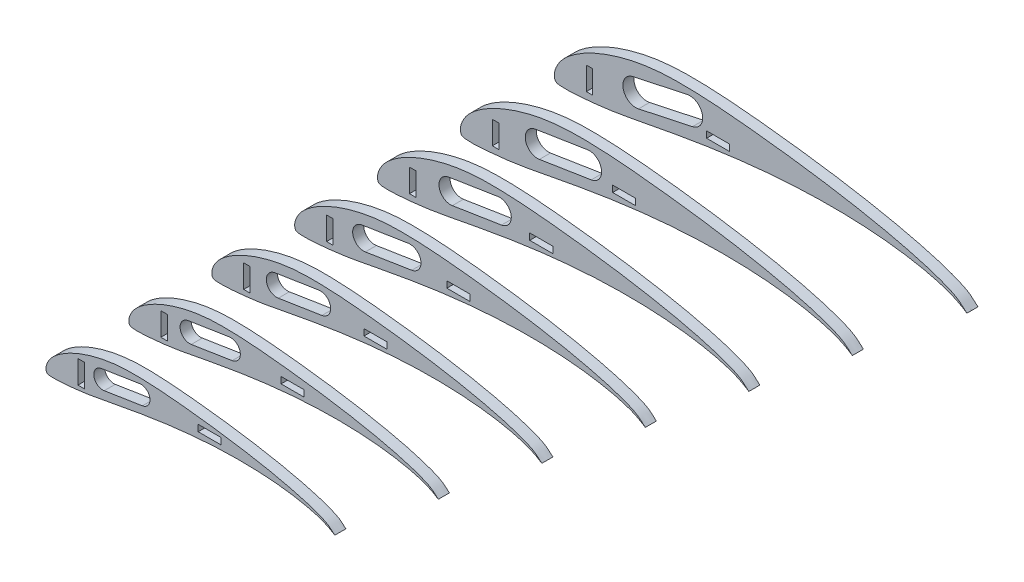
from build123d import *

# Parameters (mm, degrees)
BOSS_EXTRUDE1_DEPTH  = 6
CUT_EXTRUDE1_DEPTH   = 10
BOSS_EXTRUDE8_DEPTH  = 6
BOSS_EXTRUDE9_DEPTH  = 6
BOSS_EXTRUDE10_DEPTH = 6
BOSS_EXTRUDE11_DEPTH = 6
BOSS_EXTRUDE12_DEPTH = 6
BOSS_EXTRUDE13_DEPTH = 6
SKETCH11_W           = 3.5
SKETCH11_H           = 12.5
SKETCH11_W_2         = 12.5
SKETCH11_H_2         = 3.5
CUT_EXTRUDE2_DEPTH   = 362.412187266


with BuildPart() as part:
    # Sketch2 → Boss-Extrude1 (new body)
    with BuildSketch(Plane(origin=(0, 0, 0), x_dir=(0, 1, 0), z_dir=(0, 0, 1))):
        with BuildLine():
            add(Edge.make_bspline(
                [(0, -224), (0.005702412, -224.001341001), (0.554348448, -223.264970695), (1.165388694, -222.642205802), (2.44166658, -221.259416175), (3.799382204, -219.628047718), (5.168110619, -217.396475791), (6.494563188, -214.621499139), (7.878877108, -211.271449243), (9.301777091, -207.351432564), (10.753211404, -202.87973715), (12.220578138, -197.879577131), (13.696990178, -192.37895201), (15.168891242, -186.408233862), (16.625626309, -180.001654372), (18.058096621, -173.197398334), (19.458938187, -166.037015691), (20.810912823, -158.562355663), (22.112088945, -150.820487592), (23.34571141, -142.856028479), (24.514189105, -134.720484688), (25.60826243, -126.465995343), (26.624430408, -118.152347749), (27.56988806, -109.846003212), (28.420779048, -101.615725894), (29.161177978, -93.528566604), (29.749411157, -85.64140381), (30.154040087, -77.999291883), (30.328777712, -70.644746389), (30.310178033, -63.615443619), (29.966002817, -56.924495942), (29.268547246, -50.569311468), (28.282334726, -44.524019662), (27.004705112, -38.787161488), (25.50650617, -33.364630731), (23.814273297, -28.279370788), (21.967579419, -23.553008802), (19.976318444, -19.214914939), (17.880918697, -15.279001261), (15.705208923, -11.76668043), (13.478671875, -8.699978573), (11.2485017, -6.08016101), (8.990354416, -3.945219698), (6.723785626, -2.305312453), (4.518716045, -1.093954275), (2.42510695, -0.317601878), (0.492706389, 0.052330076), (-1.141646455, -0.019076802), (-2.640611366, -0.439847315), (-3.384708529, -2.003918685), (-3.489103018, -4.106833179), (-3.590282567, -6.983612367), (-3.434277467, -10.601365227), (-3.147587635, -14.919204004), (-2.688372693, -19.88907566), (-2.067035131, -25.460124636), (-1.270242167, -31.605185034), (-0.15660544, -38.321253852), (1.239876963, -45.641031053), (2.759695447, -53.601110597), (4.364405875, -62.162584264), (5.98740184, -71.271676995), (7.567774206, -80.861491288), (9.052750205, -90.857628696), (10.387855574, -101.173942968), (11.534215269, -111.717662379), (12.440365405, -122.389187836), (13.082714119, -133.081427951), (13.435848787, -143.682676261), (13.480452226, -154.077927826), (13.21349384, -164.151207334), (12.641223178, -173.787169766), (11.771024072, -182.869944039), (10.636299016, -191.291394287), (9.269973456, -198.941875925), (7.717807326, -205.731690442), (6.056920419, -211.535704676), (4.284278527, -216.285691763), (2.662084252, -219.674685277), (1.162148937, -222.173299724), (0.581698714, -223.13315995), (-0.005818341, -223.998631736), (0, -224)],
                knots=[0, 0, 0, 0, 0.000979678, 0.003648862, 0.007483499, 0.012095277, 0.017525591, 0.02405178, 0.031783051, 0.040677828, 0.050710301, 0.061833229, 0.07398925, 0.087118173, 0.101145049, 0.115990637, 0.131570422, 0.147788379, 0.164550917, 0.181757895, 0.199311955, 0.217095072, 0.234990228, 0.252856883, 0.270540594, 0.287886779, 0.304773438, 0.321101419, 0.336806063, 0.351800033, 0.366031063, 0.379615675, 0.392652963, 0.405170359, 0.417171919, 0.428603517, 0.439418959, 0.449596586, 0.459102079, 0.467907878, 0.475988301, 0.483308969, 0.489874508, 0.49580325, 0.501149412, 0.505903073, 0.510046769, 0.513579311, 0.516446927, 0.519350053, 0.523823355, 0.529973794, 0.537715654, 0.546967844, 0.557637367, 0.569620481, 0.582804124, 0.597246961, 0.613135037, 0.6304436, 0.649056124, 0.668822257, 0.689594964, 0.711189651, 0.733426689, 0.756094118, 0.778988554, 0.801889683, 0.824566598, 0.846792285, 0.868338291, 0.888978163, 0.908492011, 0.926658768, 0.943286193, 0.95816921, 0.971135822, 0.981955623, 0.990251791, 0.995852565, 0.999000406, 1, 1, 1, 1], degree=3))
        make_face()
    extrude(amount=BOSS_EXTRUDE1_DEPTH)

    # Sketch3 → Cut-Extrude1 (cut)
    with BuildSketch(Plane(origin=(0, 0, 0), x_dir=(1, 0, 0), z_dir=(0, 0, -1))):
        with BuildLine():
            Line((45.664943608, -6.8980064), (74.995985185, -13.1980064))
            ThreePointArc((74.995985185, -13.1980064), (80.369894886, -21.511916101), (72.055985185, -26.885825803))
            Line((72.055985185, -26.885825803), (42.724943608, -20.585825803))
            ThreePointArc((42.724943608, -20.585825803), (37.351033906, -12.271916101), (45.664943608, -6.8980064))
        make_face()
    extrude(amount=-CUT_EXTRUDE1_DEPTH, mode=Mode.SUBTRACT)


with BuildPart() as body_2:
    # Sketch5 → Boss-Extrude8 (new body)
    with BuildSketch(Plane(origin=(0, 0, -45), x_dir=(-1, 0, 0), z_dir=(0, 0, -1))):
        with BuildLine():
            add(Edge.make_bspline(
                [(-212.8, 0), (-212.79870015, -0.005527424), (-211.976501953, 0.552613778), (-211.064634738, 1.10404149), (-208.690951013, 2.528980039), (-205.471407175, 4.0700646), (-200.958919443, 5.754074398), (-195.44510592, 7.33191696), (-188.994782128, 8.806474783), (-181.726824573, 10.104484065), (-173.726446837, 11.182472868), (-165.097811278, 12.009162019), (-155.943646967, 12.552819148), (-146.374031435, 12.806429614), (-136.498542448, 12.764056347), (-126.427356553, 12.428578413), (-116.269728444, 11.818347135), (-106.13177926, 10.957504505), (-96.115245819, 9.868462796), (-86.314747261, 8.600112694), (-76.818416723, 7.189385496), (-67.708093146, 5.688031748), (-59.054455051, 4.146185582), (-50.921055067, 2.621710675), (-43.3589795, 1.177883115), (-36.405191159, -0.148775168), (-30.024925782, -1.206730058), (-24.187118405, -1.963683374), (-18.894621877, -2.553954058), (-14.173243804, -2.990208253), (-10.071296965, -3.262563593), (-6.634431749, -3.410768438), (-3.90149152, -3.314647867), (-1.90372275, -3.215473103), (-0.417854949, -2.508580798), (-0.018122962, -1.084564133), (0.049713573, 0.46807107), (-0.301721784, 2.303851603), (-1.039256561, 4.292780243), (-2.190046831, 6.387596345), (-3.747958713, 8.540836695), (-5.77615296, 10.686076615), (-8.264979645, 12.804738281), (-11.178346408, 14.919948477), (-14.515051198, 16.986872762), (-18.254169192, 18.977502521), (-22.375358362, 20.869200448), (-26.865402249, 22.623559632), (-31.696399194, 24.231180862), (-36.847803413, 25.654469857), (-42.297818679, 26.86821799), (-48.040845894, 27.805119884), (-54.078271145, 28.467702677), (-60.434671438, 28.794669132), (-67.11250907, 28.812338826), (-74.099327289, 28.646338083), (-81.359333619, 28.261940599), (-88.852138273, 27.703119079), (-96.534939599, 26.999740095), (-104.353703051, 26.191393657), (-112.244730361, 25.293208887), (-120.142695576, 24.327849308), (-127.984460453, 23.28847965), (-135.713227055, 22.178425839), (-143.279463212, 21.006484498), (-150.63423788, 19.770367182), (-157.735164906, 18.485991277), (-164.537528417, 17.15519179), (-171.001571654, 15.794344994), (-177.087822169, 14.41044668), (-182.76000441, 13.012140669), (-187.985598274, 11.609549231), (-192.735750292, 10.215550833), (-196.983860936, 8.836688236), (-200.707876781, 7.484933253), (-203.890424182, 6.169835028), (-206.526652002, 4.909705088), (-208.646645332, 3.609413094), (-210.196445366, 2.319583251), (-211.510095512, 1.107119259), (-212.10172216, 0.526631026), (-212.801273951, 0.005417291), (-212.8, 0)],
                knots=[0, 0, 0, 0, 0.000999594, 0.004147435, 0.009748209, 0.018044377, 0.028864178, 0.04183079, 0.056713807, 0.073341232, 0.091507989, 0.111021837, 0.131661709, 0.153207715, 0.175433402, 0.198110317, 0.221011446, 0.243905882, 0.266573311, 0.288810349, 0.310405036, 0.331177743, 0.350943876, 0.3695564, 0.386864963, 0.402753039, 0.417195876, 0.430379519, 0.442362633, 0.453032156, 0.462284346, 0.470026206, 0.476176645, 0.480649947, 0.483553073, 0.486420689, 0.489953231, 0.494096927, 0.498850588, 0.50419675, 0.510125492, 0.516691031, 0.524011699, 0.532092122, 0.540897921, 0.550403414, 0.560581041, 0.571396483, 0.582828081, 0.594829641, 0.607347037, 0.620384325, 0.633968937, 0.648199967, 0.663193937, 0.678898581, 0.695226562, 0.712113221, 0.729459406, 0.747143117, 0.765009772, 0.782904928, 0.800688045, 0.818242105, 0.835449083, 0.852211621, 0.868429578, 0.884009363, 0.898854951, 0.912881827, 0.92601075, 0.938166771, 0.949289699, 0.959322172, 0.968216949, 0.97594822, 0.982474409, 0.987904723, 0.992516501, 0.996351138, 0.999020322, 1, 1, 1, 1], degree=3))
        make_face()
        with BuildLine():
            Line((-40.804637579, 20.393372232), (-68.955851175, 24.838501372))
            ThreePointArc((-68.955851175, 24.838501372), (-76.56166448, 19.307081666), (-71.030244774, 11.701268361))
            Line((-71.030244774, 11.701268361), (-42.879031178, 7.25613922))
            ThreePointArc((-42.879031178, 7.25613922), (-35.273217873, 12.787558927), (-40.804637579, 20.393372232))
        make_face(mode=Mode.SUBTRACT)
    extrude(amount=BOSS_EXTRUDE8_DEPTH)


with BuildPart() as body_3:
    # Sketch6 → Boss-Extrude9 (new body)
    with BuildSketch(Plane(origin=(0, 0, -90), x_dir=(-1, 0, 0), z_dir=(0, 0, -1))):
        with BuildLine():
            add(Edge.make_bspline(
                [(-201.6, 0), (-201.598768563, -0.005236507), (-200.819843955, 0.523528843), (-199.955969751, 1.045934044), (-197.707216749, 2.395875827), (-194.657122586, 3.855850674), (-190.382134209, 5.451228377), (-185.158521398, 6.946026594), (-179.047688332, 8.34297611), (-172.162254859, 9.572669115), (-164.582949635, 10.593921664), (-156.408452789, 11.37710086), (-147.7360866, 11.892144456), (-138.670135043, 12.132407003), (-129.314408635, 12.092263908), (-119.773285155, 11.774442707), (-110.150269052, 11.196328865), (-100.545896141, 10.380793742), (-91.056548671, 9.349070017), (-81.771865826, 8.147475184), (-72.775342159, 6.810996786), (-64.144509296, 5.388661656), (-55.946325838, 3.927965288), (-48.240999537, 2.483725902), (-41.076927948, 1.115889267), (-34.489128466, -0.140944896), (-28.44466653, -1.14321795), (-22.914112173, -1.860331618), (-17.900168094, -2.419535423), (-13.427283603, -2.832828872), (-9.541228704, -3.09084972), (-6.285251131, -3.23125431), (-3.696149861, -3.140192716), (-1.803526816, -3.046237676), (-0.395862583, -2.37655023), (-0.017169122, -1.02748181), (0.047097069, 0.44343575), (-0.28584169, 2.182596255), (-0.984558847, 4.06684444), (-2.074781208, 6.051407064), (-3.550697728, 8.091318975), (-5.472144909, 10.12365153), (-7.829980716, 12.130804687), (-10.590012387, 14.134688031), (-13.751101135, 16.092826828), (-17.293423446, 17.978686599), (-21.197707922, 19.770821477), (-25.451433709, 21.432845967), (-30.028167658, 22.955855553), (-34.908445339, 24.304234601), (-40.071617695, 25.454101254), (-45.512380321, 26.341692522), (-51.232046348, 26.969402536), (-57.253899257, 27.27916023), (-63.58027175, 27.295899941), (-70.199362695, 27.138636078), (-77.077263429, 26.774470041), (-84.175709943, 26.245060181), (-91.454153304, 25.578701143), (-98.861402891, 24.812899254), (-106.337112974, 23.961987367), (-113.819395809, 23.047436187), (-121.248436219, 22.062770195), (-128.570425631, 21.011140269), (-135.738438833, 19.900880051), (-142.706120097, 18.72982154), (-149.433314122, 17.513044368), (-155.877658501, 16.252286959), (-162.001488935, 14.963063678), (-167.767410476, 13.652002118), (-173.141056809, 12.32729116), (-178.091619418, 10.998520324), (-182.591763435, 9.677890263), (-186.616289308, 8.371599382), (-190.144304319, 7.090989397), (-193.159349225, 5.845106869), (-195.656828212, 4.651299557), (-197.665242946, 3.419443984), (-199.133474557, 2.197499922), (-200.377985222, 1.048849825), (-200.938473626, 0.498913603), (-201.601206901, 0.005132171), (-201.6, 0)],
                knots=[0, 0, 0, 0, 0.000999594, 0.004147435, 0.009748209, 0.018044377, 0.028864178, 0.04183079, 0.056713807, 0.073341232, 0.091507989, 0.111021837, 0.131661709, 0.153207715, 0.175433402, 0.198110317, 0.221011446, 0.243905882, 0.266573311, 0.288810349, 0.310405036, 0.331177743, 0.350943876, 0.3695564, 0.386864963, 0.402753039, 0.417195876, 0.430379519, 0.442362633, 0.453032156, 0.462284346, 0.470026206, 0.476176645, 0.480649947, 0.483553073, 0.486420689, 0.489953231, 0.494096927, 0.498850588, 0.50419675, 0.510125492, 0.516691031, 0.524011699, 0.532092122, 0.540897921, 0.550403414, 0.560581041, 0.571396483, 0.582828081, 0.594829641, 0.607347037, 0.620384325, 0.633968937, 0.648199967, 0.663193937, 0.678898581, 0.695226562, 0.712113221, 0.729459406, 0.747143117, 0.765009772, 0.782904928, 0.800688045, 0.818242105, 0.835449083, 0.852211621, 0.868429578, 0.884009363, 0.898854951, 0.912881827, 0.92601075, 0.938166771, 0.949289699, 0.959322172, 0.968216949, 0.97594822, 0.982474409, 0.987904723, 0.992516501, 0.996351138, 0.999020322, 1, 1, 1, 1], degree=3))
        make_face()
        with BuildLine():
            Line((-38.657025075, 19.320036851), (-65.32659585, 23.531211826))
            ThreePointArc((-65.32659585, 23.531211826), (-72.532103192, 18.290919473), (-67.291810839, 11.085412131))
            Line((-67.291810839, 11.085412131), (-40.622240063, 6.874237156))
            ThreePointArc((-40.622240063, 6.874237156), (-33.416732722, 12.114529509), (-38.657025075, 19.320036851))
        make_face(mode=Mode.SUBTRACT)
    extrude(amount=BOSS_EXTRUDE9_DEPTH)


with BuildPart() as body_4:
    # Sketch7 → Boss-Extrude10 (new body)
    with BuildSketch(Plane(origin=(0, 0, -135), x_dir=(-1, 0, 0), z_dir=(0, 0, -1))):
        with BuildLine():
            add(Edge.make_bspline(
                [(-190.4, 0), (-190.398836976, -0.00494559), (-189.663185958, 0.494443907), (-188.847304765, 0.987826597), (-186.723482486, 2.262771614), (-183.842837998, 3.641636748), (-179.805348975, 5.148382356), (-174.871936876, 6.560136228), (-169.100594536, 7.879477437), (-162.597685144, 9.040854164), (-155.439452433, 10.005370461), (-147.719094301, 10.745039701), (-139.528526234, 11.231469764), (-130.966238652, 11.458384392), (-122.130274822, 11.420471469), (-113.119213758, 11.120307001), (-104.03080966, 10.574310595), (-94.960013022, 9.804082978), (-85.997851523, 8.829677238), (-77.228984391, 7.694837674), (-68.732267595, 6.432608075), (-60.580925446, 5.089291564), (-52.838196625, 3.709744994), (-45.560944008, 2.34574113), (-38.794876395, 1.053895418), (-32.573065774, -0.133114624), (-26.864407279, -1.079705842), (-21.641105941, -1.756979861), (-16.905714311, -2.285116789), (-12.681323403, -2.67544949), (-9.011160443, -2.919135847), (-5.936070512, -3.051740182), (-3.490808202, -2.965737565), (-1.703330882, -2.87700225), (-0.373870217, -2.244519661), (-0.016215282, -0.970399487), (0.044480565, 0.418800431), (-0.269961596, 2.061340908), (-0.929861134, 3.840908638), (-1.959515585, 5.715217782), (-3.353436743, 7.641801254), (-5.168136859, 9.561226445), (-7.394981787, 11.456871094), (-10.001678365, 13.349427584), (-12.987151072, 15.198780893), (-16.332677699, 16.979870677), (-20.020057482, 18.672442506), (-24.03746517, 20.242132302), (-28.359936121, 21.680530245), (-32.969087264, 22.953999346), (-37.845416712, 24.039984517), (-42.983914747, 24.878265159), (-48.385821551, 25.471102395), (-54.073127076, 25.763651328), (-60.048034431, 25.779461055), (-66.2993981, 25.630934074), (-72.795193238, 25.286999483), (-79.499281613, 24.787001282), (-86.37336701, 24.15766219), (-93.36910273, 23.434404851), (-100.429495586, 22.630765847), (-107.496096041, 21.767023065), (-114.512411985, 20.83706074), (-121.427624207, 19.843854698), (-128.197414453, 18.795275603), (-134.778002314, 17.689275899), (-141.131463337, 16.540097459), (-147.217788584, 15.349382128), (-153.001406217, 14.131782363), (-158.446998783, 12.893557556), (-163.522109209, 11.642441651), (-168.197640561, 10.387491417), (-172.447776577, 9.140229693), (-176.24871768, 7.906510527), (-179.580731857, 6.697045542), (-182.428274268, 5.520378709), (-184.787004422, 4.392894026), (-186.68384056, 3.229474874), (-188.070503749, 2.075416593), (-189.245874932, 0.99058039), (-189.775225091, 0.471196181), (-190.401139851, 0.00484705), (-190.4, 0)],
                knots=[0, 0, 0, 0, 0.000999594, 0.004147435, 0.009748209, 0.018044377, 0.028864178, 0.04183079, 0.056713807, 0.073341232, 0.091507989, 0.111021837, 0.131661709, 0.153207715, 0.175433402, 0.198110317, 0.221011446, 0.243905882, 0.266573311, 0.288810349, 0.310405036, 0.331177743, 0.350943876, 0.3695564, 0.386864963, 0.402753039, 0.417195876, 0.430379519, 0.442362633, 0.453032156, 0.462284346, 0.470026206, 0.476176645, 0.480649947, 0.483553073, 0.486420689, 0.489953231, 0.494096927, 0.498850588, 0.50419675, 0.510125492, 0.516691031, 0.524011699, 0.532092122, 0.540897921, 0.550403414, 0.560581041, 0.571396483, 0.582828081, 0.594829641, 0.607347037, 0.620384325, 0.633968937, 0.648199967, 0.663193937, 0.678898581, 0.695226562, 0.712113221, 0.729459406, 0.747143117, 0.765009772, 0.782904928, 0.800688045, 0.818242105, 0.835449083, 0.852211621, 0.868429578, 0.884009363, 0.898854951, 0.912881827, 0.92601075, 0.938166771, 0.949289699, 0.959322172, 0.968216949, 0.97594822, 0.982474409, 0.987904723, 0.992516501, 0.996351138, 0.999020322, 1, 1, 1, 1], degree=3))
        make_face()
        with BuildLine():
            Line((-36.509412571, 18.24670147), (-61.697340525, 22.22392228))
            ThreePointArc((-61.697340525, 22.22392228), (-68.502541903, 17.27475728), (-63.553376903, 10.469555902))
            Line((-63.553376903, 10.469555902), (-38.365448949, 6.492335092))
            ThreePointArc((-38.365448949, 6.492335092), (-31.56024757, 11.441500092), (-36.509412571, 18.24670147))
        make_face(mode=Mode.SUBTRACT)
    extrude(amount=BOSS_EXTRUDE10_DEPTH)


with BuildPart() as body_5:
    # Sketch8 → Boss-Extrude11 (new body)
    with BuildSketch(Plane(origin=(0, 0, -180), x_dir=(-1, 0, 0), z_dir=(0, 0, -1))):
        with BuildLine():
            add(Edge.make_bspline(
                [(-179.2, 0), (-179.198905389, -0.004654673), (-178.50652796, 0.465358971), (-177.738639779, 0.92971915), (-175.739748222, 2.129667402), (-173.02855341, 3.427422821), (-169.228563741, 4.845536335), (-164.585352354, 6.174245861), (-159.15350074, 7.415978765), (-153.03311543, 8.509039213), (-146.295955231, 9.416819257), (-139.029735813, 10.112978542), (-131.320965867, 10.570795072), (-123.262342261, 10.78436178), (-114.946141009, 10.748679029), (-106.46514236, 10.466171295), (-97.911350268, 9.952292324), (-89.374129903, 9.227372215), (-80.939154374, 8.310284459), (-72.686102957, 7.242200164), (-64.68919303, 6.054219365), (-57.017341596, 4.789921472), (-49.730067411, 3.4915247), (-42.880888478, 2.207756358), (-36.512824842, 0.99190157), (-30.657003081, -0.125284352), (-25.284148027, -1.016193733), (-20.368099709, -1.653628105), (-15.911260528, -2.150698154), (-11.935363203, -2.518070108), (-8.481092181, -2.747421973), (-5.586889894, -2.872226053), (-3.285466543, -2.791282414), (-1.603134948, -2.707766823), (-0.351877852, -2.112489093), (-0.015261442, -0.913317164), (0.041864061, 0.394165111), (-0.254081503, 1.94008556), (-0.87516342, 3.614972836), (-1.844249963, 5.379028501), (-3.156175758, 7.192283533), (-4.864128808, 8.99880136), (-6.959982859, 10.7829375), (-9.413344344, 12.564167138), (-12.223201009, 14.304734958), (-15.371931952, 15.981054755), (-18.842407042, 17.574063535), (-22.623496631, 19.051418638), (-26.691704584, 20.405204936), (-31.02972919, 21.60376409), (-35.619215729, 22.625867781), (-40.455449174, 23.414837797), (-45.539596754, 23.972802254), (-50.892354895, 24.248142427), (-56.515797111, 24.26302217), (-62.399433506, 24.12323207), (-68.513123048, 23.799528926), (-74.822853283, 23.328942383), (-81.292580715, 22.736623238), (-87.87680257, 22.055910448), (-94.521878199, 21.299544326), (-101.172796274, 20.486609944), (-107.77638775, 19.611351284), (-114.284822783, 18.676569128), (-120.656390074, 17.689671156), (-126.849884531, 16.648730258), (-132.829612552, 15.567150549), (-138.557918667, 14.446477297), (-144.001323498, 13.300501047), (-149.12658709, 12.135112994), (-153.903161608, 10.957592142), (-158.303661705, 9.77646251), (-162.30378972, 8.602569123), (-165.881146051, 7.441421672), (-169.017159395, 6.303101686), (-171.697199311, 5.19565055), (-173.917180633, 4.134488495), (-175.702438174, 3.039505764), (-177.00753294, 1.953333264), (-178.113764642, 0.932310955), (-178.611976556, 0.443478758), (-179.201072801, 0.004561929), (-179.2, 0)],
                knots=[0, 0, 0, 0, 0.000999594, 0.004147435, 0.009748209, 0.018044377, 0.028864178, 0.04183079, 0.056713807, 0.073341232, 0.091507989, 0.111021837, 0.131661709, 0.153207715, 0.175433402, 0.198110317, 0.221011446, 0.243905882, 0.266573311, 0.288810349, 0.310405036, 0.331177743, 0.350943876, 0.3695564, 0.386864963, 0.402753039, 0.417195876, 0.430379519, 0.442362633, 0.453032156, 0.462284346, 0.470026206, 0.476176645, 0.480649947, 0.483553073, 0.486420689, 0.489953231, 0.494096927, 0.498850588, 0.50419675, 0.510125492, 0.516691031, 0.524011699, 0.532092122, 0.540897921, 0.550403414, 0.560581041, 0.571396483, 0.582828081, 0.594829641, 0.607347037, 0.620384325, 0.633968937, 0.648199967, 0.663193937, 0.678898581, 0.695226562, 0.712113221, 0.729459406, 0.747143117, 0.765009772, 0.782904928, 0.800688045, 0.818242105, 0.835449083, 0.852211621, 0.868429578, 0.884009363, 0.898854951, 0.912881827, 0.92601075, 0.938166771, 0.949289699, 0.959322172, 0.968216949, 0.97594822, 0.982474409, 0.987904723, 0.992516501, 0.996351138, 0.999020322, 1, 1, 1, 1], degree=3))
        make_face()
        with BuildLine():
            Line((-34.361800067, 17.17336609), (-58.0680852, 20.916632734))
            ThreePointArc((-58.0680852, 20.916632734), (-64.472980615, 16.258595087), (-59.814942968, 9.853699672))
            Line((-59.814942968, 9.853699672), (-36.108657834, 6.110433028))
            ThreePointArc((-36.108657834, 6.110433028), (-29.703762419, 10.768470675), (-34.361800067, 17.17336609))
        make_face(mode=Mode.SUBTRACT)
    extrude(amount=BOSS_EXTRUDE11_DEPTH)


with BuildPart() as body_6:
    # Sketch9 → Boss-Extrude12 (new body)
    with BuildSketch(Plane(origin=(0, 0, -225), x_dir=(-1, 0, 0), z_dir=(0, 0, -1))):
        with BuildLine():
            add(Edge.make_bspline(
                [(-168, 0), (-167.998973802, -0.004363756), (-167.349869963, 0.436274036), (-166.629974793, 0.871611703), (-164.756013958, 1.996563189), (-162.214268822, 3.213208895), (-158.651778507, 4.542690314), (-154.298767831, 5.788355495), (-149.206406944, 6.952480092), (-143.468545715, 7.977224262), (-137.152458029, 8.828268054), (-130.340377324, 9.480917383), (-123.1134055, 9.91012038), (-115.55844587, 10.110339169), (-107.762007196, 10.07688659), (-99.811070963, 9.812035589), (-91.791890877, 9.330274054), (-83.788246784, 8.650661451), (-75.880457226, 7.790891681), (-68.143221522, 6.789562653), (-60.646118466, 5.675830655), (-53.453757747, 4.49055138), (-46.621938198, 3.273304407), (-40.200832948, 2.069771585), (-34.23077329, 0.929907722), (-28.740940389, -0.11745408), (-23.703888775, -0.952681625), (-19.095093477, -1.550276348), (-14.916806745, -2.016279519), (-11.189403003, -2.360690726), (-7.95102392, -2.5757081), (-5.237709275, -2.692711925), (-3.080124884, -2.616827263), (-1.502939013, -2.538531397), (-0.329885486, -1.980458525), (-0.014307602, -0.856234841), (0.039247557, 0.369529792), (-0.238201409, 1.818830213), (-0.820465706, 3.389037034), (-1.72898434, 5.04283922), (-2.958914773, 6.742765812), (-4.560120758, 8.436376275), (-6.52498393, 10.109003906), (-8.825010322, 11.778906692), (-11.459250946, 13.410689023), (-14.411186205, 14.982238833), (-17.664756602, 16.475684564), (-21.209528091, 17.860704973), (-25.023473048, 19.129879628), (-29.090371116, 20.253528834), (-33.393014746, 21.211751045), (-37.926983601, 21.951410435), (-42.693371956, 22.474502113), (-47.711582714, 22.732633525), (-52.983559792, 22.746583284), (-58.499468912, 22.615530065), (-64.231052857, 22.312058368), (-70.146424953, 21.870883484), (-76.21179442, 21.315584286), (-82.384502409, 20.677416045), (-88.614260812, 19.968322806), (-94.849496507, 19.206196822), (-101.040363516, 18.385641829), (-107.142021359, 17.509283557), (-113.115365694, 16.584066709), (-118.921766747, 15.608184617), (-124.527761768, 14.59420364), (-129.898048751, 13.543572466), (-135.001240779, 12.469219732), (-139.806175397, 11.376668432), (-144.284214008, 10.272742633), (-148.409682848, 9.165433603), (-152.159802862, 8.064908553), (-155.513574423, 6.976332818), (-158.453586933, 5.909157831), (-160.966124354, 4.870922391), (-163.047356843, 3.876082964), (-164.721035788, 2.849536653), (-165.944562131, 1.831249935), (-166.981654352, 0.87404152), (-167.448728021, 0.415761336), (-168.001005751, 0.004276809), (-168, 0)],
                knots=[0, 0, 0, 0, 0.000999594, 0.004147435, 0.009748209, 0.018044377, 0.028864178, 0.04183079, 0.056713807, 0.073341232, 0.091507989, 0.111021837, 0.131661709, 0.153207715, 0.175433402, 0.198110317, 0.221011446, 0.243905882, 0.266573311, 0.288810349, 0.310405036, 0.331177743, 0.350943876, 0.3695564, 0.386864963, 0.402753039, 0.417195876, 0.430379519, 0.442362633, 0.453032156, 0.462284346, 0.470026206, 0.476176645, 0.480649947, 0.483553073, 0.486420689, 0.489953231, 0.494096927, 0.498850588, 0.50419675, 0.510125492, 0.516691031, 0.524011699, 0.532092122, 0.540897921, 0.550403414, 0.560581041, 0.571396483, 0.582828081, 0.594829641, 0.607347037, 0.620384325, 0.633968937, 0.648199967, 0.663193937, 0.678898581, 0.695226562, 0.712113221, 0.729459406, 0.747143117, 0.765009772, 0.782904928, 0.800688045, 0.818242105, 0.835449083, 0.852211621, 0.868429578, 0.884009363, 0.898854951, 0.912881827, 0.92601075, 0.938166771, 0.949289699, 0.959322172, 0.968216949, 0.97594822, 0.982474409, 0.987904723, 0.992516501, 0.996351138, 0.999020322, 1, 1, 1, 1], degree=3))
        make_face()
        with BuildLine():
            Line((-32.214187563, 16.100030709), (-54.438829875, 19.609343188))
            ThreePointArc((-54.438829875, 19.609343188), (-60.443419327, 15.242432894), (-56.076509032, 9.237843443))
            Line((-56.076509032, 9.237843443), (-33.851866719, 5.728530963))
            ThreePointArc((-33.851866719, 5.728530963), (-27.847277268, 10.095441258), (-32.214187563, 16.100030709))
        make_face(mode=Mode.SUBTRACT)
    extrude(amount=BOSS_EXTRUDE12_DEPTH)


with BuildPart() as body_7:
    # Sketch10 → Boss-Extrude13 (new body)
    with BuildSketch(Plane(origin=(0, 0, -270), x_dir=(-1, 0, 0), z_dir=(0, 0, -1))):
        with BuildLine():
            add(Edge.make_bspline(
                [(-156.8, 0), (-156.799042216, -0.004072839), (-156.193211965, 0.4071891), (-155.521309807, 0.813504256), (-153.772279694, 1.863458976), (-151.399984234, 2.998994969), (-148.074993273, 4.239844293), (-144.012183309, 5.402465129), (-139.259313147, 6.488981419), (-133.903976001, 7.445409311), (-128.008960827, 8.23971685), (-121.651018836, 8.848856224), (-114.905845134, 9.249445688), (-107.854549478, 9.436316558), (-100.577873383, 9.405094151), (-93.156999565, 9.157899883), (-85.672431485, 8.708255784), (-78.202363665, 8.073950688), (-70.821760078, 7.271498902), (-63.600340087, 6.336925143), (-56.603043902, 5.297441944), (-49.890173897, 4.191181288), (-43.513808985, 3.055084113), (-37.520777418, 1.931786813), (-31.948721737, 0.867913874), (-26.824877696, -0.109623808), (-22.123629524, -0.889169517), (-17.822087246, -1.446924592), (-13.922352962, -1.881860885), (-10.443442803, -2.203311345), (-7.420955659, -2.403994227), (-4.888528657, -2.513197797), (-2.874783225, -2.442372112), (-1.402743079, -2.36929597), (-0.30789312, -1.848427956), (-0.013353762, -0.799152519), (0.036631054, 0.344894472), (-0.222321315, 1.697574865), (-0.765767992, 3.163101231), (-1.613718717, 4.706649938), (-2.761653788, 6.293248091), (-4.256112707, 7.87395119), (-6.089985001, 9.435070312), (-8.236676301, 10.993646246), (-10.695300883, 12.516643088), (-13.450440458, 13.983422911), (-16.487106162, 15.377305593), (-19.795559552, 16.669991308), (-23.355241511, 17.854554319), (-27.151013041, 18.903293579), (-31.166813763, 19.797634308), (-35.398518027, 20.487983073), (-39.847147159, 20.976201972), (-44.530810533, 21.217124623), (-49.451322472, 21.230144398), (-54.599504318, 21.107828061), (-59.948982667, 20.82458781), (-65.469996623, 20.412824585), (-71.131008126, 19.894545333), (-76.892202248, 19.298921642), (-82.706643424, 18.637101286), (-88.52619674, 17.925783701), (-94.304339281, 17.159932374), (-99.999219935, 16.341997987), (-105.574341314, 15.478462262), (-110.993648964, 14.567638976), (-116.225910983, 13.621256731), (-121.238178834, 12.640667635), (-126.001158061, 11.637938416), (-130.485763703, 10.61822387), (-134.665266407, 9.587893125), (-138.515703992, 8.554404696), (-142.015816005, 7.527247982), (-145.146002795, 6.511243963), (-147.89001447, 5.515213976), (-150.235049397, 4.546194231), (-152.177533054, 3.617677433), (-153.739633402, 2.659567543), (-154.881591322, 1.709166606), (-155.849544062, 0.815772086), (-156.285479487, 0.388043914), (-156.800938701, 0.003991688), (-156.8, 0)],
                knots=[0, 0, 0, 0, 0.000999594, 0.004147435, 0.009748209, 0.018044377, 0.028864178, 0.04183079, 0.056713807, 0.073341232, 0.091507989, 0.111021837, 0.131661709, 0.153207715, 0.175433402, 0.198110317, 0.221011446, 0.243905882, 0.266573311, 0.288810349, 0.310405036, 0.331177743, 0.350943876, 0.3695564, 0.386864963, 0.402753039, 0.417195876, 0.430379519, 0.442362633, 0.453032156, 0.462284346, 0.470026206, 0.476176645, 0.480649947, 0.483553073, 0.486420689, 0.489953231, 0.494096927, 0.498850588, 0.50419675, 0.510125492, 0.516691031, 0.524011699, 0.532092122, 0.540897921, 0.550403414, 0.560581041, 0.571396483, 0.582828081, 0.594829641, 0.607347037, 0.620384325, 0.633968937, 0.648199967, 0.663193937, 0.678898581, 0.695226562, 0.712113221, 0.729459406, 0.747143117, 0.765009772, 0.782904928, 0.800688045, 0.818242105, 0.835449083, 0.852211621, 0.868429578, 0.884009363, 0.898854951, 0.912881827, 0.92601075, 0.938166771, 0.949289699, 0.959322172, 0.968216949, 0.97594822, 0.982474409, 0.987904723, 0.992516501, 0.996351138, 0.999020322, 1, 1, 1, 1], degree=3))
        make_face()
        with BuildLine():
            Line((-30.066575058, 15.026695329), (-50.80957455, 18.302053643))
            ThreePointArc((-50.80957455, 18.302053643), (-56.413858038, 14.226270701), (-52.338075097, 8.621987213))
            Line((-52.338075097, 8.621987213), (-31.595075605, 5.346628899))
            ThreePointArc((-31.595075605, 5.346628899), (-25.990792117, 9.422411841), (-30.066575058, 15.026695329))
        make_face(mode=Mode.SUBTRACT)
    extrude(amount=BOSS_EXTRUDE13_DEPTH)


with BuildPart() as cut_extrude2_tool:
    # Sketch11 → Cut-Extrude2 (new, through all)
    with BuildSketch(Plane.XY.offset(6)):
        with Locations((19.078069496, 7.093934586)):
            Rectangle(SKETCH11_W, SKETCH11_H)
        with Locations((88.885446067, 13.322749846)):
            Rectangle(SKETCH11_W_2, SKETCH11_H_2)
    extrude(amount=-CUT_EXTRUDE2_DEPTH)


with BuildPart() as part_1:
    add(part.part)

    # Cut-Extrude2: cut by cut_extrude2_tool
    add(cut_extrude2_tool.part, mode=Mode.SUBTRACT)


with BuildPart() as body_2_1:
    add(body_2.part)

    # Cut-Extrude2: cut by cut_extrude2_tool
    add(cut_extrude2_tool.part, mode=Mode.SUBTRACT)


with BuildPart() as body_3_1:
    add(body_3.part)

    # Cut-Extrude2: cut by cut_extrude2_tool
    add(cut_extrude2_tool.part, mode=Mode.SUBTRACT)


with BuildPart() as body_4_1:
    add(body_4.part)

    # Cut-Extrude2: cut by cut_extrude2_tool
    add(cut_extrude2_tool.part, mode=Mode.SUBTRACT)


with BuildPart() as body_5_1:
    add(body_5.part)

    # Cut-Extrude2: cut by cut_extrude2_tool
    add(cut_extrude2_tool.part, mode=Mode.SUBTRACT)


with BuildPart() as body_6_1:
    add(body_6.part)

    # Cut-Extrude2: cut by cut_extrude2_tool
    add(cut_extrude2_tool.part, mode=Mode.SUBTRACT)


with BuildPart() as body_7_1:
    add(body_7.part)

    # Cut-Extrude2: cut by cut_extrude2_tool
    add(cut_extrude2_tool.part, mode=Mode.SUBTRACT)


with BuildPart() as body_8:
    # Mirror3: mirrored copy
    add(body_4_1.part.mirror(Plane.XY.offset(16)))


with BuildPart() as body_9:
    # Mirror3 2: mirrored copy
    add(body_7_1.part.mirror(Plane.XY.offset(16)))


with BuildPart() as body_10:
    # Mirror3 3: mirrored copy
    add(part_1.part.mirror(Plane.XY.offset(16)))


with BuildPart() as body_11:
    # Mirror3 4: mirrored copy
    add(body_6_1.part.mirror(Plane.XY.offset(16)))


with BuildPart() as body_12:
    # Mirror3 5: mirrored copy
    add(body_5_1.part.mirror(Plane.XY.offset(16)))


with BuildPart() as body_13:
    # Mirror3 6: mirrored copy
    add(body_3_1.part.mirror(Plane.XY.offset(16)))


with BuildPart() as body_14:
    # Mirror3 7: mirrored copy
    add(body_2_1.part.mirror(Plane.XY.offset(16)))


solid = Compound([body_8.part, body_9.part, body_10.part, body_11.part, body_12.part, body_13.part, body_14.part])
